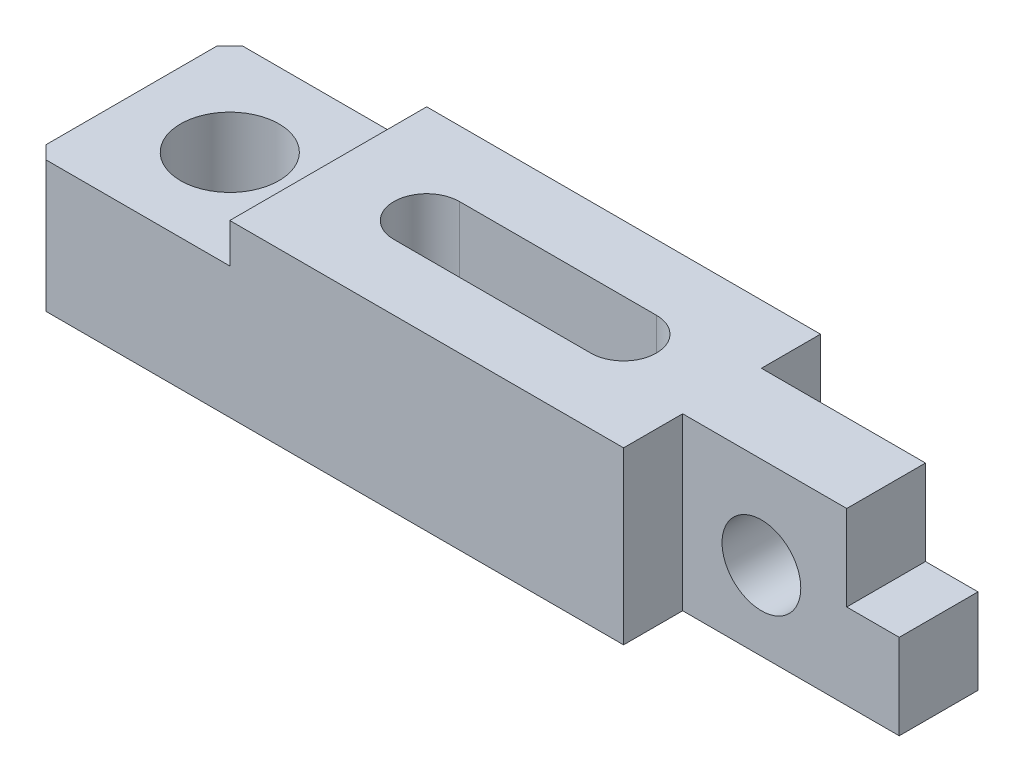
from build123d import *

# Parameters (mm, degrees)
ESTRUSIONE_ESTRUSIONE1_DEPTH = 15
TAGLIO_ESTRUSIONE1_REACH     = 128.61
SCHIZZO5_W                   = 33
SCHIZZO5_H                   = 9
TAGLIO_ESTRUSIONE2_REACH     = 128.61
FORO_15_0_15_2_D             = 15
FORO_12_0_12_2_D             = 12
SMUSSO1_SIZE                 = 2


with BuildPart() as part:
    # Schizzo1 → Estrusione-Estrusione1 (new, symmetric)
    with BuildSketch(Plane.XY):
        Polygon((0, 0), (0, 20), (30, 20), (30, 26), (115, 26), (115, 13), (123, 13), (123, 0), align=None)
    extrude(amount=ESTRUSIONE_ESTRUSIONE1_DEPTH, both=True)

    # Schizzo5 → Taglio-Estrusione1 (cut, up to next)
    with BuildSketch(Plane(origin=(0, 26, 0), x_dir=(1, 0, 0), z_dir=(0, 1, 0)), mode=Mode.PRIVATE) as taglio_estrusione1_sk1:
        with Locations((106.5, 10.5)):
            Rectangle(SCHIZZO5_W, SCHIZZO5_H)
    taglio_estrusione1_tool1 = extrude(taglio_estrusione1_sk1.sketch, amount=-TAGLIO_ESTRUSIONE1_REACH, mode=Mode.PRIVATE) & part.part
    # Schizzo5 → Taglio-Estrusione1 (cut, up to next)
    with BuildSketch(Plane(origin=(0, 26, 0), x_dir=(1, 0, 0), z_dir=(0, 1, 0)), mode=Mode.PRIVATE) as taglio_estrusione1_sk2:
        with Locations((106.5, -10.5)):
            Rectangle(SCHIZZO5_W, SCHIZZO5_H)
    taglio_estrusione1_tool2 = extrude(taglio_estrusione1_sk2.sketch, amount=-TAGLIO_ESTRUSIONE1_REACH, mode=Mode.PRIVATE) & part.part
    add(taglio_estrusione1_tool1.solids().sort_by_distance((106.5, 26, -10.5))[0], mode=Mode.SUBTRACT)
    add(taglio_estrusione1_tool2.solids().sort_by_distance((106.5, 26, 10.5))[0], mode=Mode.SUBTRACT)

    # Schizzo6 → Taglio-Estrusione2 (cut, up to next)
    with BuildSketch(Plane(origin=(0, 26, 0), x_dir=(1, 0, 0), z_dir=(0, 1, 0)), mode=Mode.PRIVATE) as taglio_estrusione2_sk1:
        with BuildLine():
            Line((45, 5), (75, 5))
            ThreePointArc((75, 5), (80, 0), (75, -5))
            Line((75, -5), (45, -5))
            ThreePointArc((45, -5), (40, 0), (45, 5))
        make_face()
    taglio_estrusione2_tool1 = extrude(taglio_estrusione2_sk1.sketch, amount=-TAGLIO_ESTRUSIONE2_REACH, mode=Mode.PRIVATE) & part.part
    add(taglio_estrusione2_tool1.solids().sort_by_distance((60, 26, 0))[0], mode=Mode.SUBTRACT)

    # Foro Ø15.0 (15)-2 (through all)
    with Locations(Plane(origin=(15, 20, 0), x_dir=(0, 0, 1), z_dir=(0, 1, 0))):
        with Locations((0, 0)):
            Hole(FORO_15_0_15_2_D / 2)

    # Foro Ø12.0 (12)-2 (through all)
    with Locations(Plane(origin=(102, 12, 6), x_dir=(1, 0, 0), z_dir=(0, 0, 1))):
        with Locations((0, 0)):
            Hole(FORO_12_0_12_2_D / 2)

    # Smusso1
    smusso1_edges = [part.edges().sort_by_distance(p)[0] for p in [
        (0, 10, -15),
        (0, 10, 15),
    ]]
    chamfer(smusso1_edges, length=SMUSSO1_SIZE)


solid = part.part
